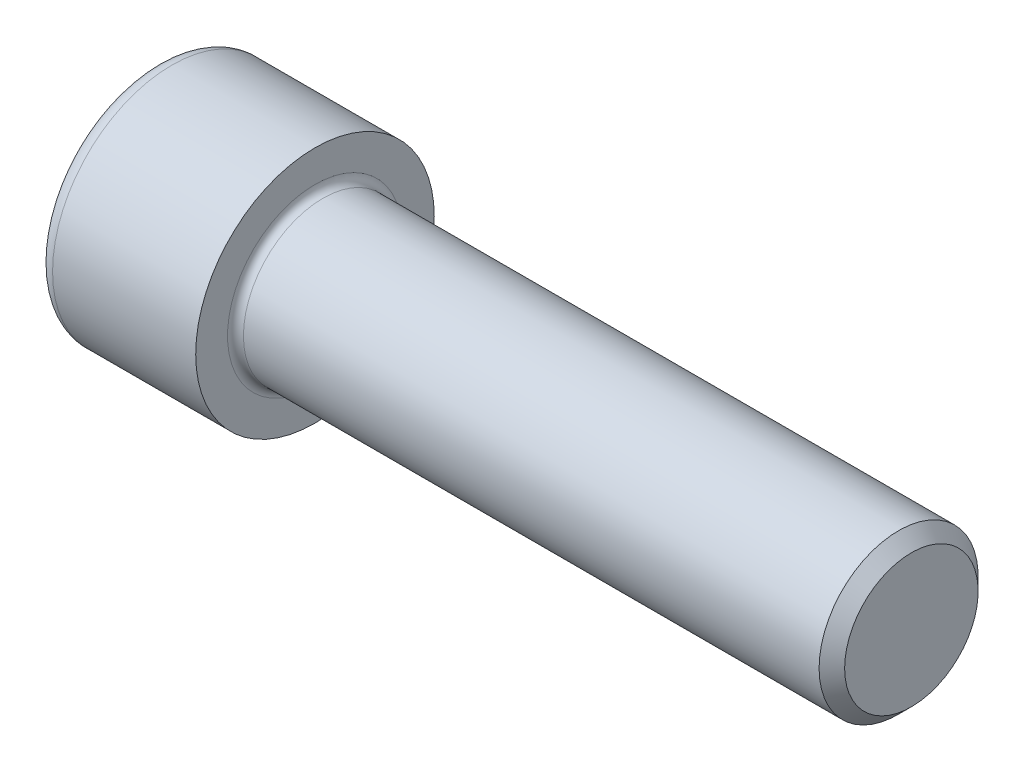
from build123d import *

# Parameters (mm, degrees)
FILLET1_R   = 0.6
FILLET2_R   = 1.2
HEX_2_DEPTH = 6


with BuildPart() as part:
    # BodySke → Base-Revolve (revolve)
    with BuildSketch(Plane.XY, mode=Mode.PRIVATE) as base_revolve_sk:
        Polygon((0, 0), (0, 9), (12, 9), (12, 6), (56.036, 6), (57, 5.036), (57, 0), align=None)
    revolve(base_revolve_sk.sketch.rotate(Axis((-31.75, 0, 0), (1, 0, 0)), 90), axis=Axis((-31.75, 0, 0), (1, 0, 0)))

    # Fillet1
    fillet1_edges = [part.edges().sort_by_distance(p)[0] for p in [
        (12, 0, -6),
    ]]
    fillet(fillet1_edges, radius=FILLET1_R)

    # Fillet2
    fillet2_edges = [part.edges().sort_by_distance(p)[0] for p in [
        (0, 0, -9),
    ]]
    fillet(fillet2_edges, radius=FILLET2_R)

    # Sketch2 → Hex-PreBroach (revolve, cut)
    with BuildSketch(Plane.XY, mode=Mode.PRIVATE) as hex_prebroach_sk:
        Polygon((0, 5.0125), (6, 5.0125), (8.893968224, 0), (0, 0), align=None)
    revolve(hex_prebroach_sk.sketch.rotate(Axis((0, 0, 0), (1, 0, 0)), 90), axis=Axis((0, 0, 0), (1, 0, 0)), mode=Mode.SUBTRACT)

    # Sketch3 → Hex 2 (cut)
    with BuildSketch(Plane(origin=(0, 0, 0), x_dir=(0, 0.500000000000001, 0.866025403784438), z_dir=(-1, 0, 0))):
        Polygon((2.893968224, 5.0125), (-2.893968224, 5.0125), (-5.787936449, 0), (-2.893968224, -5.0125), (2.893968224, -5.0125), (5.787936449, 0), align=None)
    extrude(amount=-HEX_2_DEPTH, mode=Mode.SUBTRACT)


solid = part.part
